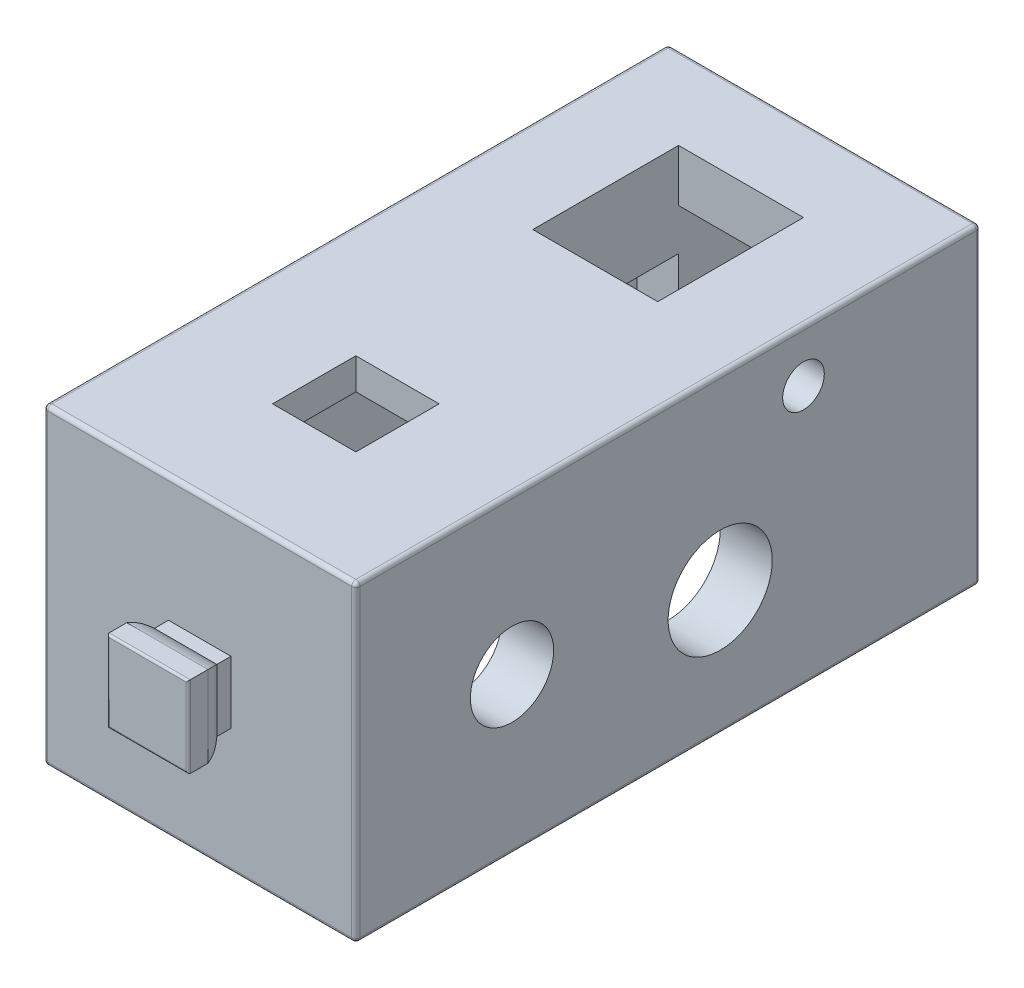
from build123d import *

# Parameters (mm, degrees)
SKETCH_1_W           = 15
SKETCH_1_H           = 15
EXTRUDE_1_DEPTH      = 30
SKETCH_2_W           = 3
SKETCH_2_H           = 3
EXTRUDE_2_DEPTH      = 1
EXTRUDE_3_DEPTH      = 1
EXTRUDE_3_DEPTH_BACK = 4
CUT_EXTRUDE_1_REACH  = 36.847
FILLET_1_R           = 0.1
CUT_EXTRUDE_2_DEPTH  = 13.5
SKETCH_6_W           = 10
SKETCH_6_H           = 8.5
EXTRUDE_4_DEPTH      = 3
SKETCH_7_W           = 6
SKETCH_7_H           = 4
EXTRUDE_5_DEPTH      = 1
SKETCH_8_W           = 6
SKETCH_8_H           = 7
CUT_EXTRUDE_3_DEPTH  = 33.657311586
CUT_EXTRUDE_4_DEPTH  = 13.5
CUT_EXTRUDE_5_REACH  = 36.369
SKETCH_11_W          = 4
SKETCH_11_H          = 4
CUT_EXTRUDE_6_REACH  = 38.742
SKETCH_12_R          = 2.5
SKETCH_12_R_2        = 2
SKETCH_12_R_3        = 1
CUT_EXTRUDE_7_REACH  = 37.795
SKETCH_14_R          = 2
SKETCH_14_R_2        = 1
SKETCH_14_R_3        = 1.25
FILLET_2_R           = 0.2


with BuildPart() as part:
    # 草图1 → 凸台-拉伸1 (new body)
    with BuildSketch(Plane.XY):
        with Locations((0, 7.5)):
            Rectangle(SKETCH_1_W, SKETCH_1_H)
    extrude(amount=-EXTRUDE_1_DEPTH)

    # 草图2 → 凸台-拉伸2 (add)
    with BuildSketch(Plane.XY):
        with Locations((0, 7.5)):
            Rectangle(SKETCH_2_W, SKETCH_2_H)
    extrude(amount=EXTRUDE_2_DEPTH)

    # 草图3 → 凸台-拉伸3 (add, two sides: drawn at the far end of the back side and taken through both)
    with BuildSketch(Plane.XZ.offset(-6).offset(-EXTRUDE_3_DEPTH_BACK)):
        with BuildLine():
            Line((-1.95, 2.5), (1.95, 2.5))
            Line((1.95, 2.5), (1.95, 1.555590279))
            ThreePointArc((1.95, 1.555590279), (1.780042303, 1.088161527), (1.5, 0.677124344))
            Line((1.5, 0.677124344), (-1.5, 0.677124344))
            ThreePointArc((-1.5, 0.677124344), (-1.780042303, 1.088161527), (-1.95, 1.555590279))
            Line((-1.95, 1.555590279), (-1.95, 2.5))
        make_face()
    extrude(amount=EXTRUDE_3_DEPTH + EXTRUDE_3_DEPTH_BACK)

    # 草图4 → 切除-拉伸1 (cut, up to next)
    with BuildSketch(Plane.ZY.offset(1.95), mode=Mode.PRIVATE) as cut_extrude_1_sk1:
        with BuildLine():
            Line((2.5, 9.45), (1.555590279, 9.45))
            ThreePointArc((1.555590279, 9.45), (1.088161527, 9.280042303), (0.677124344, 9))
            Line((0.677124344, 9), (0.677124344, 10))
            Line((0.677124344, 10), (2.5, 10))
            Line((2.5, 10), (2.5, 9.45))
        make_face()
    cut_extrude_1_tool1 = extrude(cut_extrude_1_sk1.sketch, amount=-CUT_EXTRUDE_1_REACH, mode=Mode.PRIVATE) & part.part
    # 草图4 → 切除-拉伸1 (cut, up to next)
    with BuildSketch(Plane.ZY.offset(1.95), mode=Mode.PRIVATE) as cut_extrude_1_sk2:
        with BuildLine():
            Line((2.5, 5.55), (1.555590279, 5.55))
            ThreePointArc((1.555590279, 5.55), (1.088161527, 5.719957697), (0.677124344, 6))
            Line((0.677124344, 6), (0.677124344, 5))
            Line((0.677124344, 5), (2.5, 5))
            Line((2.5, 5), (2.5, 5.55))
        make_face()
    cut_extrude_1_tool2 = extrude(cut_extrude_1_sk2.sketch, amount=-CUT_EXTRUDE_1_REACH, mode=Mode.PRIVATE) & part.part
    add(cut_extrude_1_tool1.solids().sort_by_distance((-1.95, 9.669375, 1.500125))[0], mode=Mode.SUBTRACT)
    add(cut_extrude_1_tool2.solids().sort_by_distance((-1.95, 5.330625, 1.500125))[0], mode=Mode.SUBTRACT)

    # 圆角1
    fillet_1_edges = [part.edges().sort_by_distance(p)[0] for p in [
        (1.95, 7.5, 2.5),
        (-1.95, 7.5, 2.5),
        (0, 9.45, 2.5),
        (0, 5.55, 2.5),
    ]]
    fillet(fillet_1_edges, radius=FILLET_1_R)

    # 草图5 → 切除-拉伸2 (cut)
    with BuildSketch(Plane.XZ):
        Polygon((-5, -1.5), (5, -1.5), (5, -26), (3, -26), (3, -30), (-3, -30), (-3, -26), (-5, -26), align=None)
    extrude(amount=-CUT_EXTRUDE_2_DEPTH, mode=Mode.SUBTRACT)

    # 草图6 → 凸台-拉伸4 (add)
    with BuildSketch(Plane.XZ.offset(-13.5)):
        with Locations((0, -21.75)):
            Rectangle(SKETCH_6_W, SKETCH_6_H)
    extrude(amount=EXTRUDE_4_DEPTH)

    # 草图7 → 凸台-拉伸5 (add)
    with BuildSketch(Plane.XZ.offset(-13.5)):
        with Locations((0, -28)):
            Rectangle(SKETCH_7_W, SKETCH_7_H)
    extrude(amount=EXTRUDE_5_DEPTH)

    # 草图8 → 切除-拉伸3 (cut, through all)
    with BuildSketch(Plane.XZ.offset(-10.5)):
        with Locations((0, -22.5)):
            Rectangle(SKETCH_8_W, SKETCH_8_H)
    extrude(amount=-CUT_EXTRUDE_3_DEPTH, mode=Mode.SUBTRACT)

    # 草图10 → 切除-拉伸4 (cut)
    with BuildSketch(Plane.XZ):
        with BuildLine():
            Line((-5.75, -30), (-5.75, -29.361437828))
            ThreePointArc((-5.75, -29.361437828), (-5, -27.7), (-4.25, -29.361437828))
            Line((-4.25, -29.361437828), (-4.25, -30))
            Line((-4.25, -30), (-5.75, -30))
        make_face()
        with BuildLine():
            Line((5.75, -30), (4.25, -30))
            Line((4.25, -30), (4.25, -29.361437828))
            ThreePointArc((4.25, -29.361437828), (5, -27.7), (5.75, -29.361437828))
            Line((5.75, -29.361437828), (5.75, -30))
        make_face()
    extrude(amount=-CUT_EXTRUDE_4_DEPTH, mode=Mode.SUBTRACT)

    # 草图11 → 切除-拉伸5 (cut, up to next)
    with BuildSketch(Plane(origin=(0, 15, 0), x_dir=(-1, 0, 0), z_dir=(0, 1, 0)), mode=Mode.PRIVATE) as cut_extrude_5_sk1:
        with Locations((0, -7.5)):
            Rectangle(SKETCH_11_W, SKETCH_11_H)
    cut_extrude_5_tool1 = extrude(cut_extrude_5_sk1.sketch, amount=-CUT_EXTRUDE_5_REACH, mode=Mode.PRIVATE) & part.part
    add(cut_extrude_5_tool1.solids().sort_by_distance((0, 15, -7.5))[0], mode=Mode.SUBTRACT)

    # 草图12 → 切除-拉伸6 (cut, up to next)
    with BuildSketch(Plane(origin=(7.5, 0, 0), x_dir=(0, 0, -1), z_dir=(1, 0, 0)), mode=Mode.PRIVATE) as cut_extrude_6_sk1:
        with Locations((17.5, 6)):
            Circle(SKETCH_12_R)
    cut_extrude_6_tool1 = extrude(cut_extrude_6_sk1.sketch, amount=-CUT_EXTRUDE_6_REACH, mode=Mode.PRIVATE) & part.part
    # 草图12 → 切除-拉伸6 (cut, up to next)
    with BuildSketch(Plane(origin=(7.5, 0, 0), x_dir=(0, 0, -1), z_dir=(1, 0, 0)), mode=Mode.PRIVATE) as cut_extrude_6_sk2:
        with Locations((7.5, 7.5)):
            Circle(SKETCH_12_R_2)
    cut_extrude_6_tool2 = extrude(cut_extrude_6_sk2.sketch, amount=-CUT_EXTRUDE_6_REACH, mode=Mode.PRIVATE) & part.part
    # 草图12 → 切除-拉伸6 (cut, up to next)
    with BuildSketch(Plane(origin=(7.5, 0, 0), x_dir=(0, 0, -1), z_dir=(1, 0, 0)), mode=Mode.PRIVATE) as cut_extrude_6_sk3:
        with Locations((21.5, 12.5)):
            Circle(SKETCH_12_R_3)
    cut_extrude_6_tool3 = extrude(cut_extrude_6_sk3.sketch, amount=-CUT_EXTRUDE_6_REACH, mode=Mode.PRIVATE) & part.part
    add(cut_extrude_6_tool1.solids().sort_by_distance((7.5, 6, -17.5))[0], mode=Mode.SUBTRACT)
    add(cut_extrude_6_tool2.solids().sort_by_distance((7.5, 7.5, -7.5))[0], mode=Mode.SUBTRACT)
    add(cut_extrude_6_tool3.solids().sort_by_distance((7.5, 12.5, -21.5))[0], mode=Mode.SUBTRACT)

    # 草图14 → 切除-拉伸7 (cut, up to next)
    with BuildSketch(Plane(origin=(-5, 0, 0), x_dir=(0, 0, -1), z_dir=(1, 0, 0)), mode=Mode.PRIVATE) as cut_extrude_7_sk1:
        with Locations((7.5, 7.5)):
            Circle(SKETCH_14_R)
    cut_extrude_7_tool1 = extrude(cut_extrude_7_sk1.sketch, amount=-CUT_EXTRUDE_7_REACH, mode=Mode.PRIVATE) & part.part
    # 草图14 → 切除-拉伸7 (cut, up to next)
    with BuildSketch(Plane(origin=(-5, 0, 0), x_dir=(0, 0, -1), z_dir=(1, 0, 0)), mode=Mode.PRIVATE) as cut_extrude_7_sk2:
        with Locations((21.5, 12.5)):
            Circle(SKETCH_14_R_2)
    cut_extrude_7_tool2 = extrude(cut_extrude_7_sk2.sketch, amount=-CUT_EXTRUDE_7_REACH, mode=Mode.PRIVATE) & part.part
    # 草图14 → 切除-拉伸7 (cut, up to next)
    with BuildSketch(Plane(origin=(-5, 0, 0), x_dir=(0, 0, -1), z_dir=(1, 0, 0)), mode=Mode.PRIVATE) as cut_extrude_7_sk3:
        with Locations((17.5, 6)):
            Circle(SKETCH_14_R_3)
    cut_extrude_7_tool3 = extrude(cut_extrude_7_sk3.sketch, amount=-CUT_EXTRUDE_7_REACH, mode=Mode.PRIVATE) & part.part
    add(cut_extrude_7_tool1.solids().sort_by_distance((-5, 7.5, -7.5))[0], mode=Mode.SUBTRACT)
    add(cut_extrude_7_tool2.solids().sort_by_distance((-5, 12.5, -21.5))[0], mode=Mode.SUBTRACT)
    add(cut_extrude_7_tool3.solids().sort_by_distance((-5, 6, -17.5))[0], mode=Mode.SUBTRACT)

    # 圆角2
    fillet_2_edges = [part.edges().sort_by_distance(p)[0] for p in [
        (7.5, 7.5, -30),
        (0, 15, -30),
        (-3.625, 0, -30),
        (-4.25, 6.75, -30),
        (-5.75, 6.75, -30),
        (6.625, 0, -30),
        (5.75, 6.75, -30),
        (4.25, 6.75, -30),
        (-7.5, 7.5, -30),
        (0, 15, 0),
        (7.5, 7.5, 0),
        (0, 0, 0),
        (-7.5, 7.5, 0),
        (-6.625, 0, -30),
        (-7.5, 15, -15),
        (7.5, 15, -15),
        (7.5, 0, -15),
        (-7.5, 0, -15),
        (3.625, 0, -30),
    ]]
    fillet(fillet_2_edges, radius=FILLET_2_R)


solid = part.part
